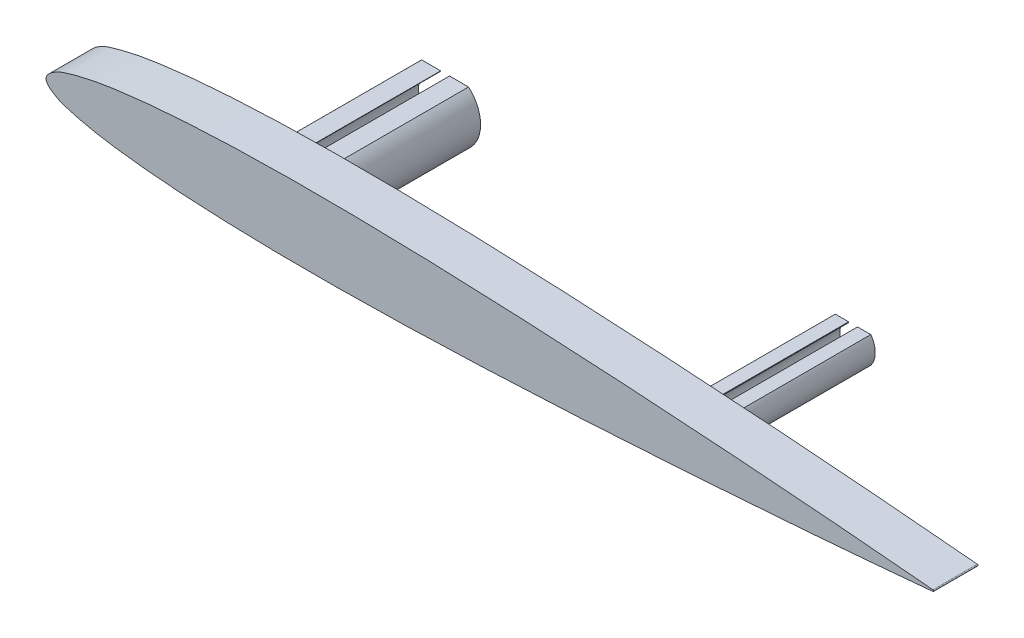
from build123d import *

# Parameters (mm, degrees)
CORPOCENTINA_DEPTH       = 5
AGGANCIOFOAM_DEPTH       = 15
AGGANCIOLONGHERONE_DEPTH = 15


with BuildPart() as part:
    # Schizzo1 → CorpoCentina (new body)
    with BuildSketch(Plane.XY):
        with BuildLine():
            ThreePointArc((100, 0.084), (100.084, 0), (100, -0.084))
            add(Edge.make_bspline(
                [(100, 0.084), (98.333488815, 0.23674648), (95.001194725, 0.542172689), (88.335559621, 1.11089898), (80.003293356, 1.763610995), (70.002998933, 2.457861693), (60.003104625, 3.061747723), (50.003008601, 3.552139212), (40.002598558, 3.902946494), (31.666961486, 4.025260151), (24.9991546, 3.976933791), (19.997775587, 3.844976398), (14.993363131, 3.592486959), (10.827184065, 3.237651579), (7.489054388, 2.814021367), (4.99359465, 2.403673059), (2.84962634, 1.867925494), (1.165413503, 1.320987252), (-0.664613784, 0), (1.165413503, -1.320987252), (2.84962634, -1.867925494), (4.99359465, -2.403673059), (7.489054388, -2.814021367), (10.827184065, -3.237651579), (14.993363131, -3.592486959), (19.997775587, -3.844976398), (24.9991546, -3.976933791), (31.666961486, -4.025260151), (40.002598558, -3.902946494), (50.003008601, -3.552139212), (60.003104625, -3.061747723), (70.002998933, -2.457861693), (80.003293356, -1.763610995), (88.335559621, -1.11089898), (95.001194725, -0.542172689), (98.333488815, -0.23674648), (100, -0.084)],
                knots=[0, 0, 0, 0, 0.024876293, 0.049741715, 0.099443402, 0.149112224, 0.198750974, 0.248359097, 0.29793737, 0.347491327, 0.37226694, 0.397050924, 0.421859475, 0.446731346, 0.459220451, 0.471790602, 0.484560454, 0.491195112, 0.5, 0.508804888, 0.515439546, 0.528209398, 0.540779549, 0.553268654, 0.578140525, 0.602949076, 0.62773306, 0.652508673, 0.70206263, 0.751640903, 0.801249026, 0.850887776, 0.900556598, 0.950258285, 0.975123707, 1, 1, 1, 1], degree=3))
        make_face()
    extrude(amount=CORPOCENTINA_DEPTH)

    # Schizzo3 → AggancioFoam (add)
    with BuildSketch(Plane(origin=(0, 0, 0), x_dir=(-1, 0, 0), z_dir=(0, 0, -1))):
        with BuildLine():
            Line((-69, -1.5), (-70.5, -1.5))
            Line((-70.5, -1.5), (-70.5, -1.414213562))
            ThreePointArc((-70.5, -1.414213562), (-69.5, 0), (-70.5, 1.414213562))
            Line((-70.5, 1.414213562), (-70.5, 1.5))
            Line((-70.5, 1.5), (-69, 1.5))
            ThreePointArc((-69, 1.5), (-68.5, 0), (-69, -1.5))
        make_face()
        with BuildLine():
            Line((-71.5, -1.5), (-71.5, -1.414213562))
            ThreePointArc((-71.5, -1.414213562), (-72.5, 0), (-71.5, 1.414213562))
            Line((-71.5, 1.414213562), (-71.5, 1.5))
            Line((-71.5, 1.5), (-73, 1.5))
            ThreePointArc((-73, 1.5), (-73.5, 0), (-73, -1.5))
            Line((-73, -1.5), (-71.5, -1.5))
        make_face()
    extrude(amount=AGGANCIOFOAM_DEPTH)

    # Schizzo2 → AggancioLongherone (add)
    with BuildSketch(Plane.XY):
        with BuildLine():
            Line((22.354248689, -3), (24.5, -3))
            Line((24.5, -3), (24.5, -2.958039892))
            ThreePointArc((24.5, -2.958039892), (22, 0), (24.5, 2.958039892))
            Line((24.5, 2.958039892), (24.5, 3))
            Line((24.5, 3), (22.354248689, 3))
            ThreePointArc((22.354248689, 3), (21, 0), (22.354248689, -3))
        make_face()
        with BuildLine():
            Line((25.5, -3), (25.5, -2.958039892))
            ThreePointArc((25.5, -2.958039892), (28, 0), (25.5, 2.958039892))
            Line((25.5, 2.958039892), (25.5, 3))
            Line((25.5, 3), (27.645751311, 3))
            ThreePointArc((27.645751311, 3), (29, 0), (27.645751311, -3))
            Line((27.645751311, -3), (25.5, -3))
        make_face()
    extrude(amount=-AGGANCIOLONGHERONE_DEPTH)


solid = part.part
